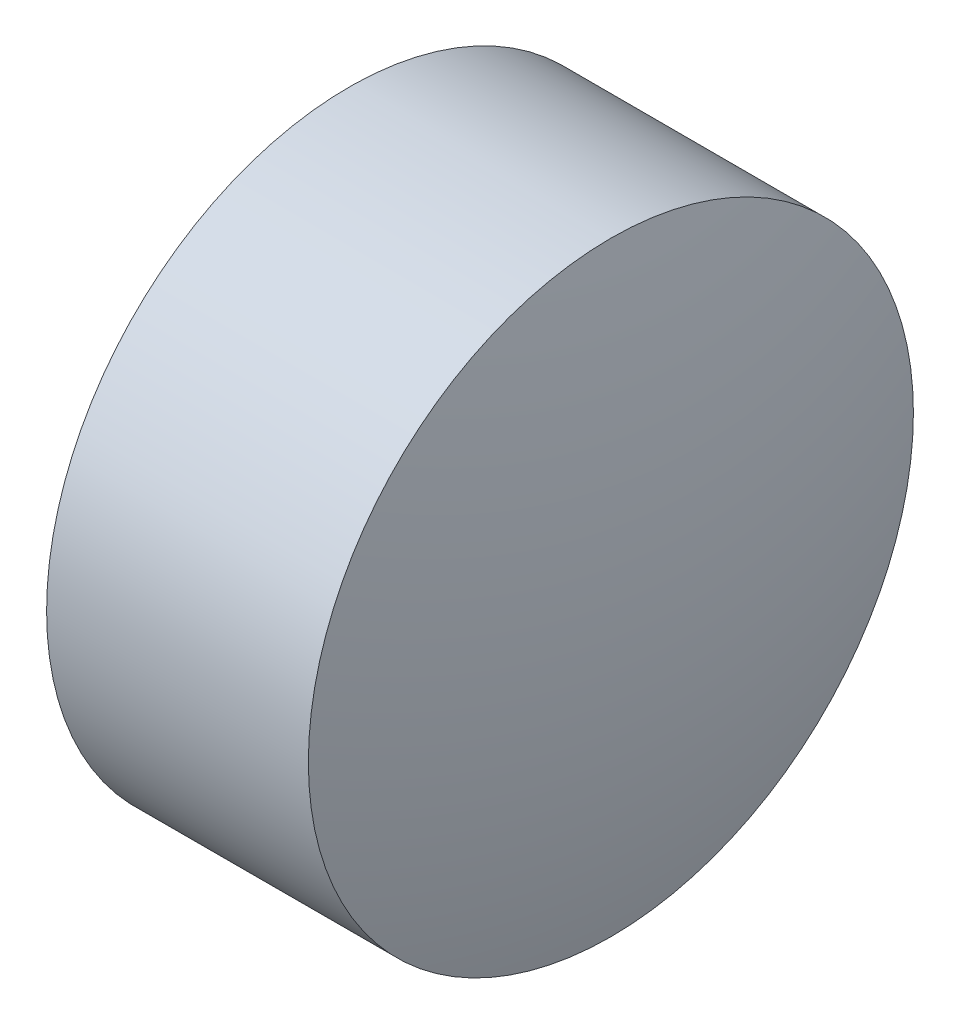
from build123d import *


with BuildPart() as part:
    # Sketch1 → Revolve2 (revolve)
    with BuildSketch(Plane.XY):
        with BuildLine():
            Line((-0.5, 0), (0.5, 0))
            ThreePointArc((0.5, 0), (0.466161419, 0.504518846), (0.365251844, 1))
            Line((0.365251844, 1), (-0.5, 1))
            Line((-0.5, 1), (-0.5, 0))
        make_face()
    revolve(axis=Axis((-0.5, 0, 0), (1, 0, 0)))


solid = part.part
